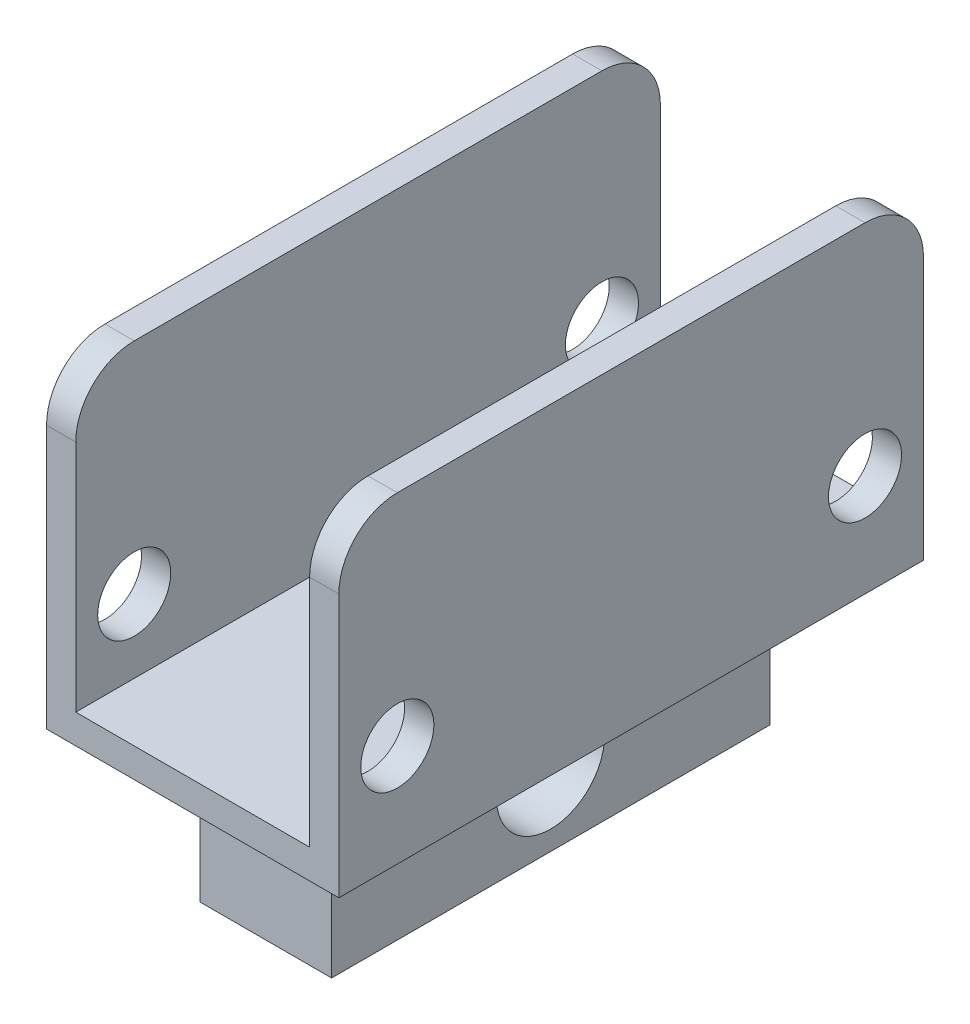
from build123d import *

# Parameters (mm, degrees)
EXTRUDE_THIN1_DEPTH = 50.8
FILLET1_R           = 5.08
SKETCH2_R           = 3.175
CUT_EXTRUDE1_DEPTH  = 63.217039467
SKETCH3_W           = 11.44
SKETCH3_H           = 38.1
BOSS_EXTRUDE1_DEPTH = 12.7
SKETCH4_R           = 4.699
CUT_EXTRUDE2_DEPTH  = 60.708428216


with BuildPart() as part:
    # Sketch1 → Extrude-Thin1 (new body)
    with BuildSketch(Plane.XY):
        Polygon((10.16, 25.4), (10.16, 0), (-10.16, 0), (-10.16, 25.4), (-12.7, 25.4), (-12.7, -2.54), (12.7, -2.54), (12.7, 25.4), align=None)
    extrude(amount=EXTRUDE_THIN1_DEPTH)

    # Fillet1
    fillet1_edges = [part.edges().sort_by_distance(p)[0] for p in [
        (-11.43, 25.4, 50.8),
        (-11.43, 25.4, 0),
        (11.43, 25.4, 50.8),
        (11.43, 25.4, 0),
    ]]
    fillet(fillet1_edges, radius=FILLET1_R)

    # Sketch2 → Cut-Extrude1 (cut, through all)
    with BuildSketch(Plane.ZY.offset(12.7)):
        with Locations((45.72, 6.35)):
            Circle(SKETCH2_R)
        with Locations((5.08, 6.35)):
            Circle(SKETCH2_R)
    extrude(amount=-CUT_EXTRUDE1_DEPTH, mode=Mode.SUBTRACT)

    # Sketch3 → Boss-Extrude1 (add)
    with BuildSketch(Plane.XZ.offset(2.54)):
        with Locations((0, 25.4)):
            Rectangle(SKETCH3_W, SKETCH3_H)
    extrude(amount=BOSS_EXTRUDE1_DEPTH)

    # Sketch4 → Cut-Extrude2 (cut, through all)
    with BuildSketch(Plane(origin=(5.72, 0, 0), x_dir=(0, 0, -1), z_dir=(1, 0, 0))):
        with Locations((-25.426069342, -8.852606466)):
            Circle(SKETCH4_R)
    extrude(amount=-CUT_EXTRUDE2_DEPTH, mode=Mode.SUBTRACT)


solid = part.part
